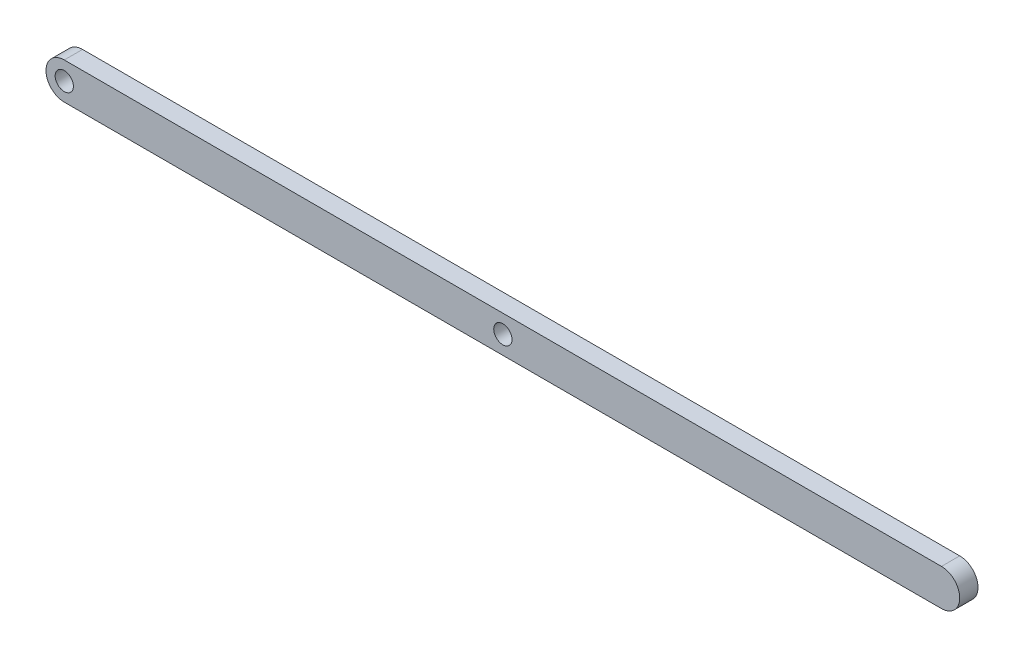
from build123d import *

# Parameters (mm, degrees)
SKETCH1_R           = 3.175
BOSS_EXTRUDE1_DEPTH = 6.35


with BuildPart() as part:
    # Sketch1 → Boss-Extrude1 (new body)
    with BuildSketch(Plane.XY):
        with BuildLine():
            Line((-152.4, 6.35), (152.4, 6.35))
            ThreePointArc((152.4, 6.35), (158.75, 0), (152.4, -6.35))
            Line((152.4, -6.35), (-152.4, -6.35))
            ThreePointArc((-152.4, -6.35), (-158.75, 0), (-152.4, 6.35))
        make_face()
        with Locations((-152.4, 0)):
            Circle(SKETCH1_R, mode=Mode.SUBTRACT)
        Circle(SKETCH1_R, mode=Mode.SUBTRACT)
    extrude(amount=BOSS_EXTRUDE1_DEPTH)


solid = part.part
